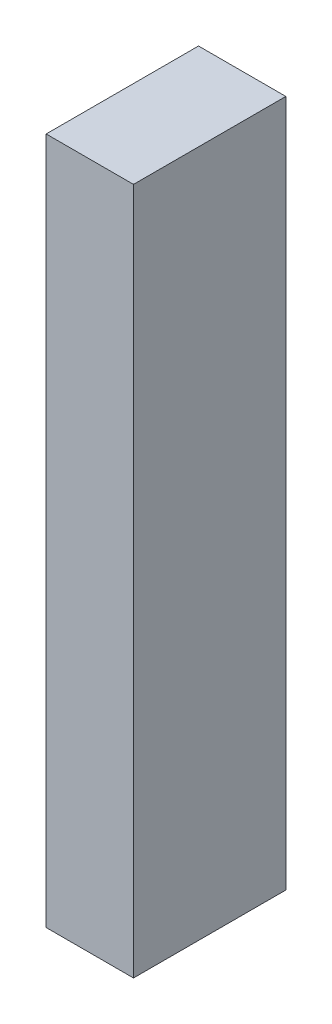
from build123d import *

# Parameters (mm, degrees)
SKICA1_W                = 4.93
SKICA1_H                = 38.8
P_IDAT_VYSUNUT_M1_DEPTH = 8.6


with BuildPart() as part:
    # Skica1 → Přidat vysunutím1 (new body)
    with BuildSketch(Plane.XY):
        Rectangle(SKICA1_W, SKICA1_H)
    extrude(amount=P_IDAT_VYSUNUT_M1_DEPTH)


solid = part.part
